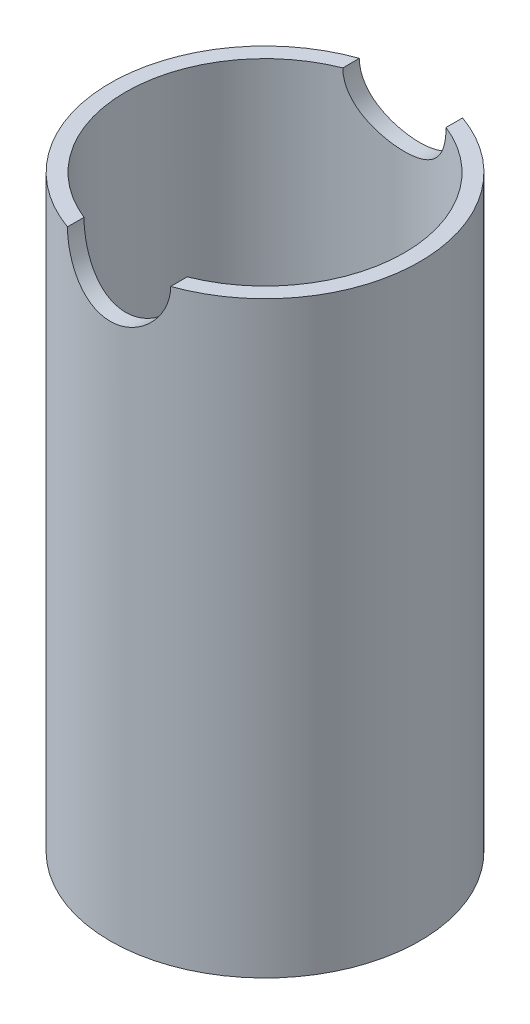
from build123d import *

# Parameters (mm, degrees)
SKETCH1_R           = 15
SKETCH1_R_2         = 3.6
BOSS_EXTRUDE1_DEPTH = 2
SKETCH1_3_R         = 15
SKETCH1_3_R_2       = 13.5
BOSS_EXTRUDE2_DEPTH = 57
SKETCH3_R           = 5
CUT_EXTRUDE2_DEPTH  = 57


with BuildPart() as part:
    # Sketch1 → Boss-Extrude1 (new body)
    with BuildSketch(Plane(origin=(0, 0, 0), x_dir=(1, 0, 0), z_dir=(0, 1, 0))):
        Circle(SKETCH1_R)
        Circle(SKETCH1_R_2, mode=Mode.SUBTRACT)
    extrude(amount=BOSS_EXTRUDE1_DEPTH)

    # Sketch1<3> → Boss-Extrude2 (add)
    with BuildSketch(Plane(origin=(0, 0, 0), x_dir=(1, 0, 0), z_dir=(0, 1, 0))):
        Circle(SKETCH1_3_R)
        Circle(SKETCH1_3_R_2, mode=Mode.SUBTRACT)
    extrude(amount=BOSS_EXTRUDE2_DEPTH)

    # Sketch3 → Cut-Extrude2 (cut)
    with BuildSketch(Plane.XY.offset(15)):
        with Locations((0, 57)):
            Circle(SKETCH3_R)
    extrude(amount=-CUT_EXTRUDE2_DEPTH, mode=Mode.SUBTRACT)


solid = part.part
